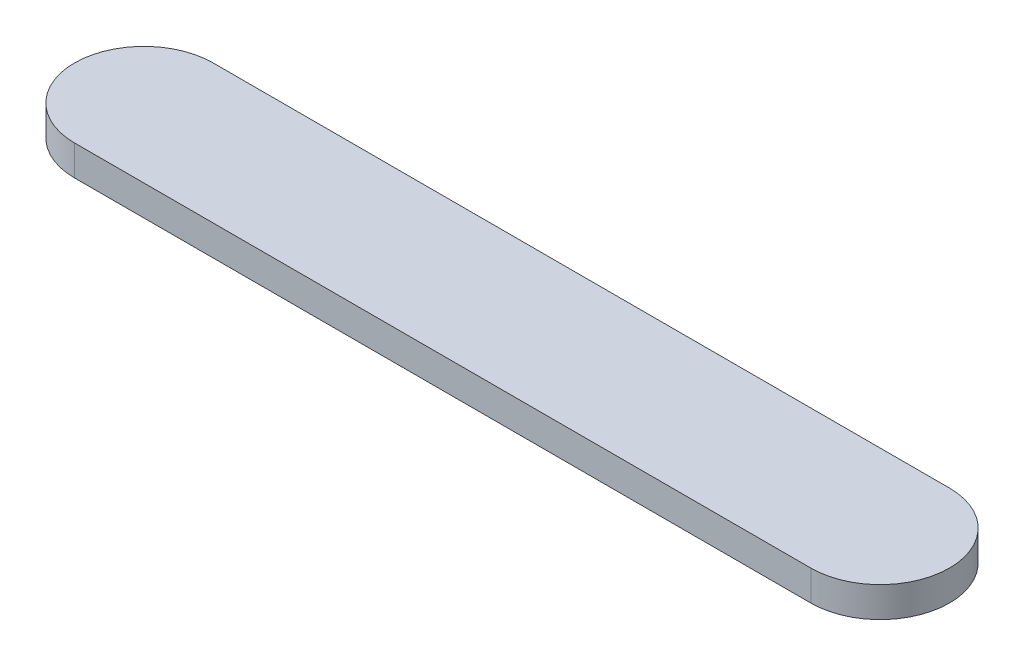
from build123d import *

# Parameters (mm, degrees)
BOSS_EXTRUDE1_DEPTH = 3.5


with BuildPart() as part:
    # Sketch1 → Boss-Extrude1 (new body)
    with BuildSketch(Plane(origin=(0, 0, 0), x_dir=(1, 0, 0), z_dir=(0, 1, 0))):
        with BuildLine():
            Line((0, 8), (85, 8))
            ThreePointArc((85, 8), (93, 0), (85, -8))
            Line((85, -8), (0, -8))
            ThreePointArc((0, -8), (-8, 0), (0, 8))
        make_face()
    extrude(amount=BOSS_EXTRUDE1_DEPTH)


solid = part.part
